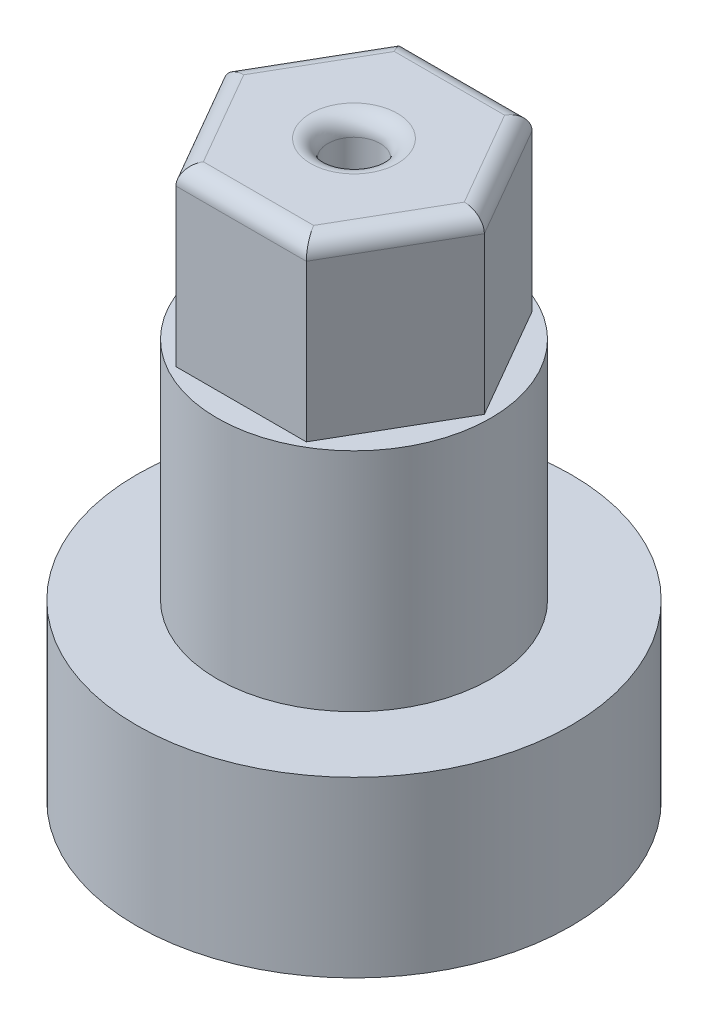
from build123d import *

# Parameters (mm, degrees)
CROQUIS1_R              = 12.5
CROQUIS1_R_2            = 0.75
SALIENTE_EXTRUIR1_DEPTH = 10
CROQUIS2_R              = 7.875
SALIENTE_EXTRUIR2_DEPTH = 13
SALIENTE_EXTRUIR3_DEPTH = 10
CROQUIS4_R              = 1.5
CORTAR_EXTRUIR1_DEPTH   = 38.436613095
REDONDEO1_R             = 1


with BuildPart() as part:
    # Croquis1 → Saliente-Extruir1 (new body)
    with BuildSketch(Plane(origin=(0, 0, 0), x_dir=(1, 0, 0), z_dir=(0, 1, 0))):
        with Locations(Location((0, 0, 0), (0, 0, 270))):
            Circle(CROQUIS1_R)
        with Locations(Location((7, 0, 0), (0, 0, 270))):
            Circle(CROQUIS1_R_2, mode=Mode.SUBTRACT)
        with Locations(Location((0, -7, 0), (0, 0, 270))):
            Circle(CROQUIS1_R_2, mode=Mode.SUBTRACT)
        with Locations(Location((-7, 0, 0), (0, 0, 270))):
            Circle(CROQUIS1_R_2, mode=Mode.SUBTRACT)
        with Locations(Location((0, 7, 0), (0, 0, 270))):
            Circle(CROQUIS1_R_2, mode=Mode.SUBTRACT)
    extrude(amount=SALIENTE_EXTRUIR1_DEPTH)

    # Croquis2 → Saliente-Extruir2 (add)
    with BuildSketch(Plane(origin=(0, 10, 0), x_dir=(1, 0, 0), z_dir=(0, 1, 0))):
        with Locations(Location((0, 0, 0), (0, 0, 90))):
            Circle(CROQUIS2_R)
    extrude(amount=SALIENTE_EXTRUIR2_DEPTH)

    # Croquis3 → Saliente-Extruir3 (add)
    with BuildSketch(Plane(origin=(0, 23, 0), x_dir=(1, 0, 0), z_dir=(0, 1, 0))):
        Polygon((7.5, 0), (3.75, 6.495190528), (-3.75, 6.495190528), (-7.5, 0), (-3.75, -6.495190528), (3.75, -6.495190528), align=None)
    extrude(amount=SALIENTE_EXTRUIR3_DEPTH)

    # Croquis4 → Cortar-Extruir1 (cut, through all)
    with BuildSketch(Plane(origin=(0, 33, 0), x_dir=(1, 0, 0), z_dir=(0, 1, 0))):
        with Locations(Location((0, 0, 0), (0, 0, 270))):
            Circle(CROQUIS4_R)
    extrude(amount=-CORTAR_EXTRUIR1_DEPTH, mode=Mode.SUBTRACT)

    # Redondeo1
    redondeo1_edges = [part.edges().sort_by_distance(p)[0] for p in [
        (5.625, 33, 3.247595264),
        (5.625, 33, -3.247595264),
        (0, 33, -6.495190528),
        (-5.625, 33, -3.247595264),
        (-5.625, 33, 3.247595264),
        (0, 33, 6.495190528),
        (0, 33, -1.5),
    ]]
    fillet(redondeo1_edges, radius=REDONDEO1_R)


solid = part.part
